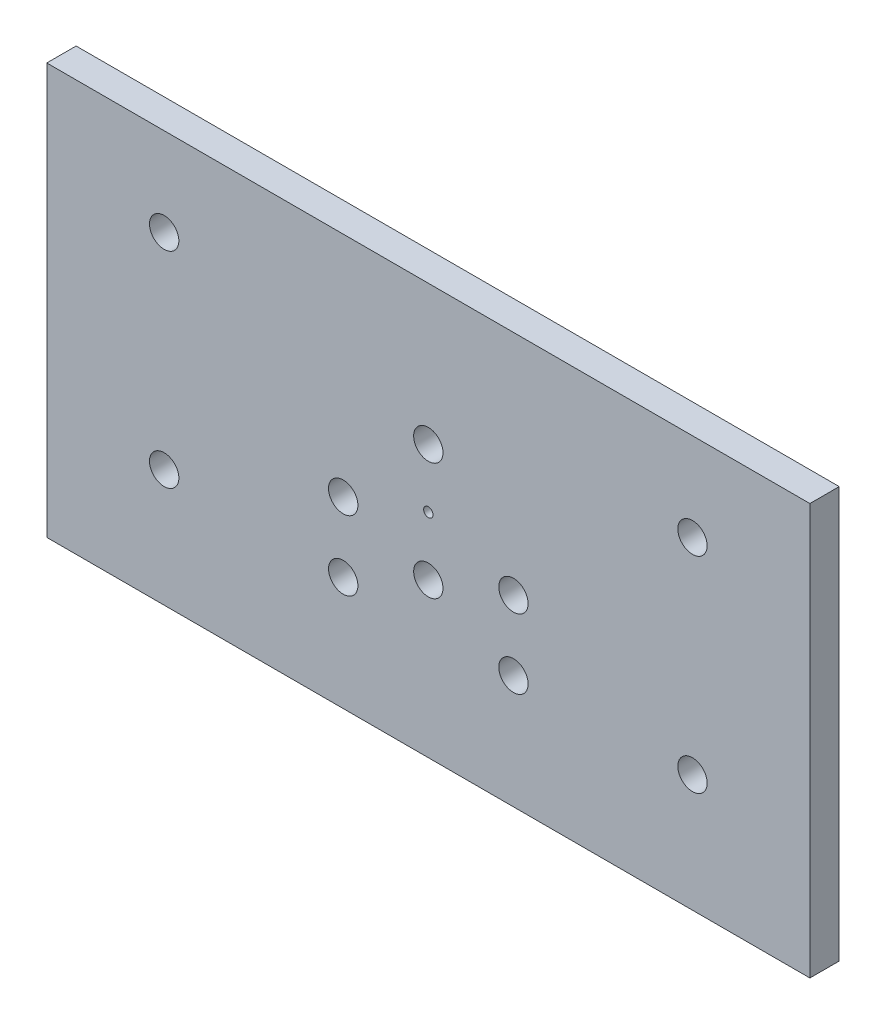
from build123d import *

# Parameters (mm, degrees)
ESQUISSE1_W             = 130
ESQUISSE1_H             = 70
ESQUISSE1_R             = 2.5
BOSS_EXTRU_4_DEPTH      = 5
ESQUISSE2_R             = 0.8
ESQUISSE2_R_2           = 2.5
ENL_V_MAT_EXTRU_1_DEPTH = 10


with BuildPart() as part:
    # Esquisse1 → Boss.-Extru.4 (new body)
    with BuildSketch(Plane.XY):
        with Locations((65, 35)):
            Rectangle(ESQUISSE1_W, ESQUISSE1_H)
        with Locations((20, 55)):
            Circle(ESQUISSE1_R, mode=Mode.SUBTRACT)
        with Locations((110, 55)):
            Circle(ESQUISSE1_R, mode=Mode.SUBTRACT)
        with Locations((50.5, 31.23)):
            Circle(ESQUISSE1_R, mode=Mode.SUBTRACT)
        with Locations((79.5, 31.23)):
            Circle(ESQUISSE1_R, mode=Mode.SUBTRACT)
        with Locations((50.5, 19.37)):
            Circle(ESQUISSE1_R, mode=Mode.SUBTRACT)
        with Locations((79.5, 19.37)):
            Circle(ESQUISSE1_R, mode=Mode.SUBTRACT)
        with Locations((20, 20)):
            Circle(ESQUISSE1_R, mode=Mode.SUBTRACT)
        with Locations((110, 20)):
            Circle(ESQUISSE1_R, mode=Mode.SUBTRACT)
    extrude(amount=BOSS_EXTRU_4_DEPTH)

    # Esquisse2 → Enlèv. mat.-Extru.1 (cut)
    with BuildSketch(Plane.XY.offset(5)):
        with Locations((65, 36.23)):
            Circle(ESQUISSE2_R)
        with Locations((65, 26.23)):
            Circle(ESQUISSE2_R_2)
        with Locations((65, 46.23)):
            Circle(ESQUISSE2_R_2)
    extrude(amount=-ENL_V_MAT_EXTRU_1_DEPTH, mode=Mode.SUBTRACT)


solid = part.part
